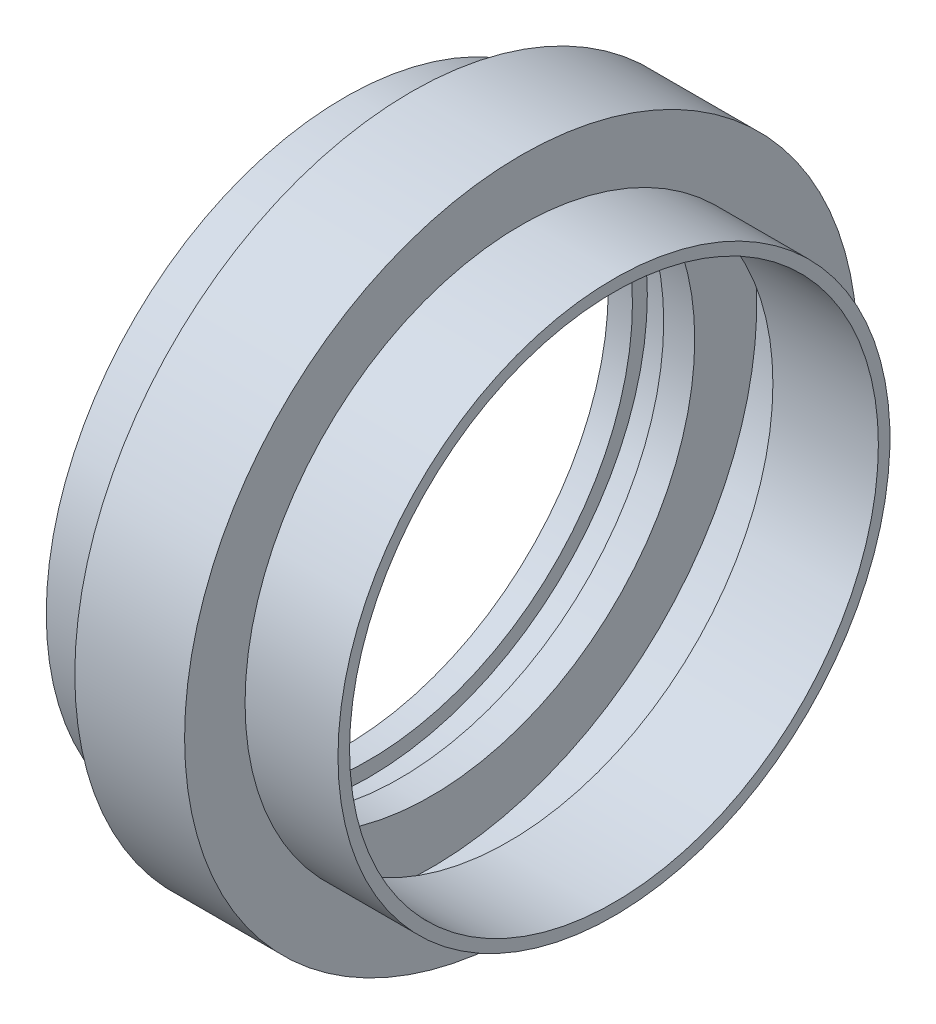
from build123d import *


with BuildPart() as part:
    # Sketch1 → Revolve5 (revolve)
    with BuildSketch(Plane.XY, mode=Mode.PRIVATE) as revolve5_sk:
        Polygon((0, 0), (0, 3.048), (6.4, 3.048), (6.4, 0), (12.75, 0), (12.75, 12.7), (28.625, 12.7), (28.625, 0.127), (50.215, 0.127), (50.215, 2.495740043), (31.192613632, 2.495740043), (31.192613632, 14.871343975), (8.716076946, 14.871343975), (8.716076946, 7.045071355), (-4.952401859, 7.045071355), (-4.952401859, 0), align=None)
    revolve(revolve5_sk.sketch.rotate(Axis((8.090941895, -54, 0), (1, 0, 0)), 90), axis=Axis((8.090941895, -54, 0), (1, 0, 0)))


solid = part.part
